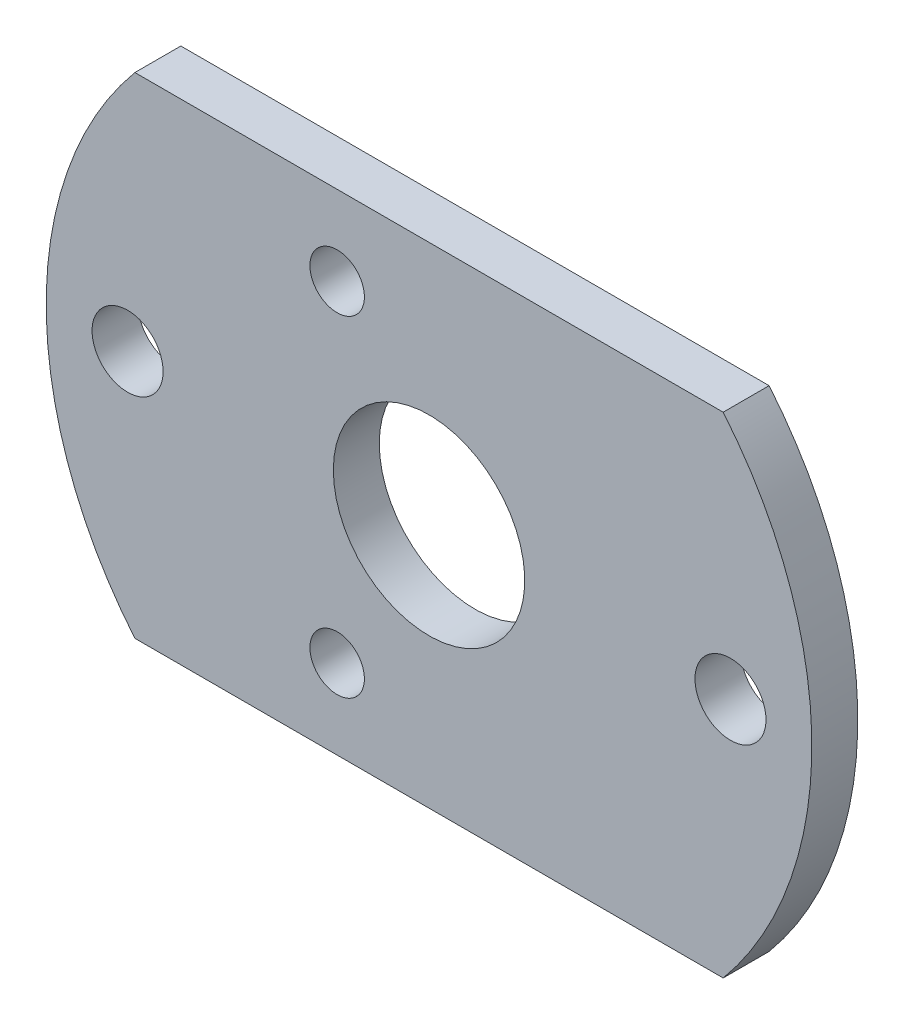
from build123d import *

# Parameters (mm, degrees)
SKETCH1_R             = 15.875
SKETCH1_R_2           = 3.96875
BOSS_EXTRUDE1_DEPTH   = 1.905
MOTORCLEARANCEHOLES_D = 2.9464
ENCODERSETSCREWS_D    = 2.2606
LINACTCUTAWAY_DEPTH   = 23.531317649


with BuildPart() as part:
    # Sketch1 → Boss-Extrude1 (new body)
    with BuildSketch(Plane.XY):
        with Locations(Location((0, 0, 0), (0, 0, 180))):
            Circle(SKETCH1_R)
        with Locations(Location((0, 0, 0), (0, 0, 180))):
            Circle(SKETCH1_R_2, mode=Mode.SUBTRACT)
    extrude(amount=BOSS_EXTRUDE1_DEPTH)

    # MotorClearanceHoles (through all)
    with Locations(Plane.XY.offset(1.905)):
        with Locations((-12.5, 0), (12.5, 0)):
            Hole(MOTORCLEARANCEHOLES_D / 2)

    # EncoderSetScrews (through all)
    with Locations(Plane.XY.offset(1.905)):
        with Locations((-3.81, 6.858), (-3.81, -6.858)):
            Hole(ENCODERSETSCREWS_D / 2)

    # Sketch8 → LinActCutaway (cut, through all)
    with BuildSketch(Plane.XY.offset(1.905)):
        with BuildLine():
            Line((-12.197951672, -10.16), (12.197951672, -10.16))
            ThreePointArc((12.197951672, -10.16), (0, -15.875), (-12.197951672, -10.16))
        make_face()
        with BuildLine():
            Line((-12.197951672, 10.16), (12.197951672, 10.16))
            ThreePointArc((12.197951672, 10.16), (0, 15.875), (-12.197951672, 10.16))
        make_face()
    extrude(amount=-LINACTCUTAWAY_DEPTH, mode=Mode.SUBTRACT)


solid = part.part
